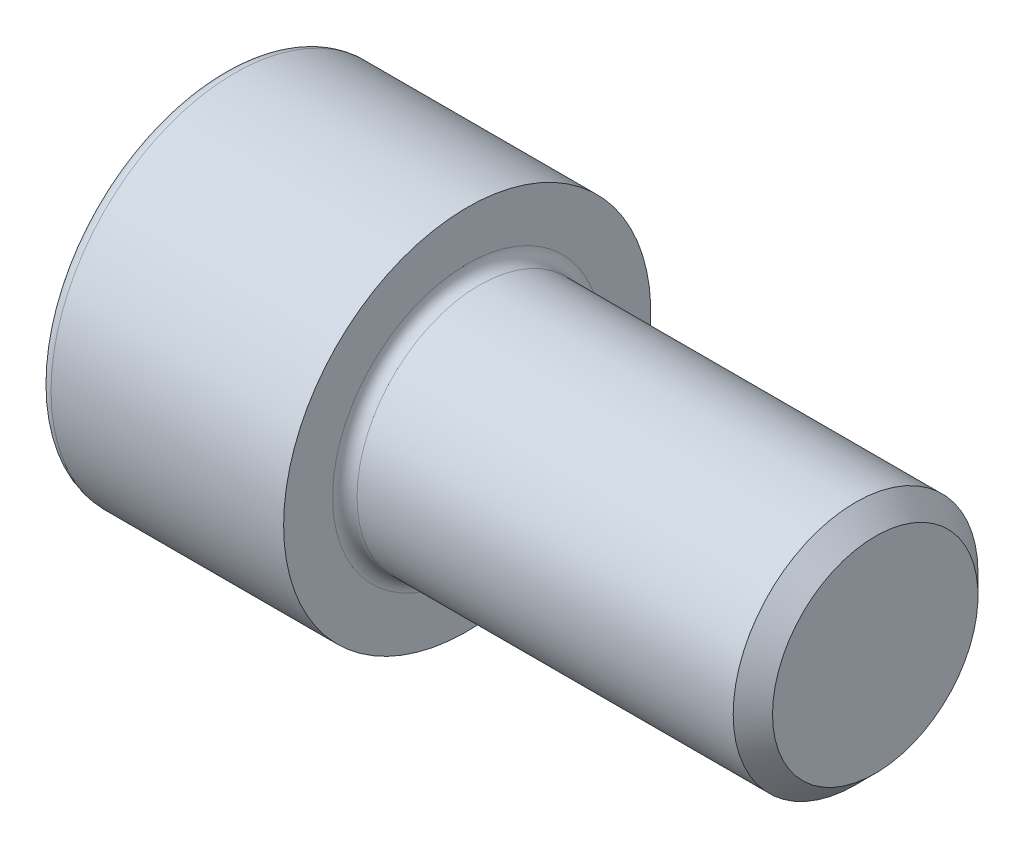
from build123d import *

# Parameters (mm, degrees)
FILLET1_R   = 0.6
FILLET2_R   = 0.6
HEX_2_DEPTH = 6


with BuildPart() as part:
    # BodySke → Base-Revolve (revolve)
    with BuildSketch(Plane.XY, mode=Mode.PRIVATE) as base_revolve_sk:
        Polygon((0, 0), (0, 9), (12, 9), (12, 6), (31.036, 6), (32, 5.036), (32, 0), align=None)
    revolve(base_revolve_sk.sketch.rotate(Axis((-31.75, 0, 0), (1, 0, 0)), 90), axis=Axis((-31.75, 0, 0), (1, 0, 0)))

    # Fillet1
    fillet1_edges = [part.edges().sort_by_distance(p)[0] for p in [
        (12, 0, -6),
    ]]
    fillet(fillet1_edges, radius=FILLET1_R)

    # Fillet2
    fillet2_edges = [part.edges().sort_by_distance(p)[0] for p in [
        (0, 0, -9),
    ]]
    fillet(fillet2_edges, radius=FILLET2_R)

    # Sketch2 → Hex-PreBroach (revolve, cut)
    with BuildSketch(Plane.XY, mode=Mode.PRIVATE) as hex_prebroach_sk:
        Polygon((0, 5.0575), (6, 5.0575), (8.919948986, 0), (0, 0), align=None)
    revolve(hex_prebroach_sk.sketch.rotate(Axis((0, 0, 0), (1, 0, 0)), 90), axis=Axis((0, 0, 0), (1, 0, 0)), mode=Mode.SUBTRACT)

    # Sketch3 → Hex 2 (cut)
    with BuildSketch(Plane(origin=(0, 0, 0), x_dir=(0, 0.500000000000001, 0.866025403784438), z_dir=(-1, 0, 0))):
        Polygon((2.919948986, 5.0575), (-2.919948986, 5.0575), (-5.839897973, 0), (-2.919948986, -5.0575), (2.919948986, -5.0575), (5.839897973, 0), align=None)
    extrude(amount=-HEX_2_DEPTH, mode=Mode.SUBTRACT)


solid = part.part
